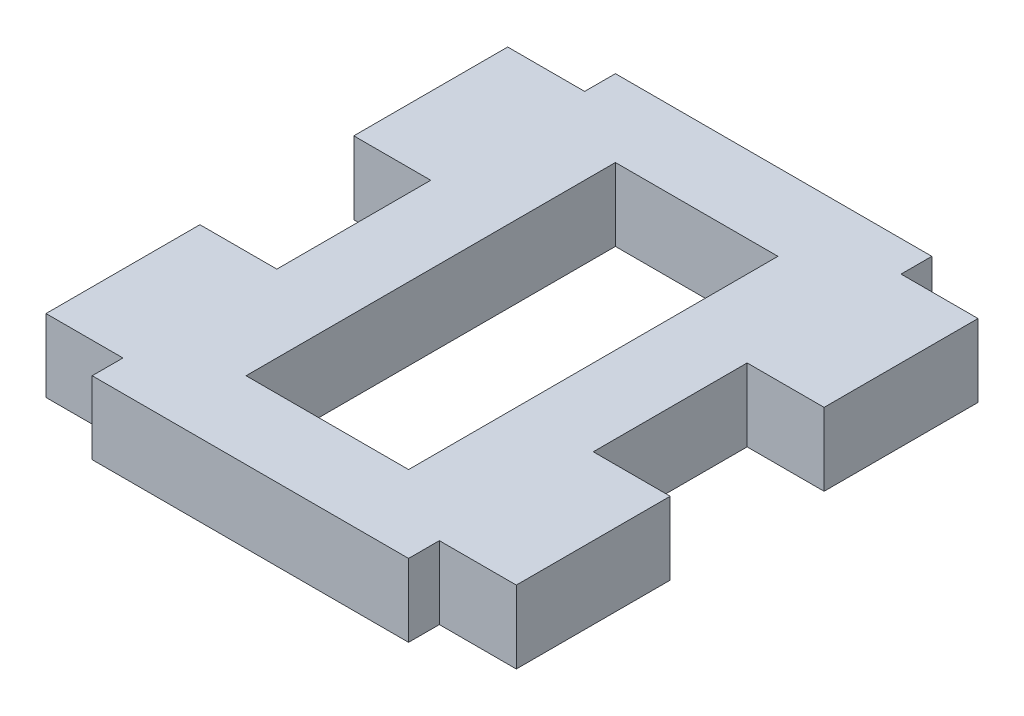
from build123d import *

# Parameters (mm, degrees)
SKETCH1_W           = 26.1112
SKETCH1_H           = 43.18
BOSS_EXTRUDE1_DEPTH = 6
SKETCH2_W           = 6.35
SKETCH2_H           = 12.7
BOSS_EXTRUDE2_DEPTH = 6
SKETCH3_W           = 13.4112
SKETCH3_H           = 30.48
CUT_EXTRUDE1_DEPTH  = 30.64296563


with BuildPart() as part:
    # Sketch1 → Boss-Extrude1 (new body)
    with BuildSketch(Plane(origin=(0, 0, 0), x_dir=(1, 0, 0), z_dir=(0, 1, 0))):
        Rectangle(SKETCH1_W, SKETCH1_H)
    extrude(amount=BOSS_EXTRUDE1_DEPTH)

    # Sketch2 → Boss-Extrude2 (add)
    with BuildSketch(Plane.XZ):
        with Locations((-16.2306, 12.7)):
            Rectangle(SKETCH2_W, SKETCH2_H)
        with Locations((16.2306, 12.7)):
            Rectangle(SKETCH2_W, SKETCH2_H)
        with Locations((16.2306, -12.7)):
            Rectangle(SKETCH2_W, SKETCH2_H)
        with Locations((-16.2306, -12.7)):
            Rectangle(SKETCH2_W, SKETCH2_H)
    extrude(amount=-BOSS_EXTRUDE2_DEPTH)

    # Sketch3 → Cut-Extrude1 (cut, through all)
    with BuildSketch(Plane.XZ):
        Rectangle(SKETCH3_W, SKETCH3_H)
    extrude(amount=-CUT_EXTRUDE1_DEPTH, mode=Mode.SUBTRACT)


solid = part.part
